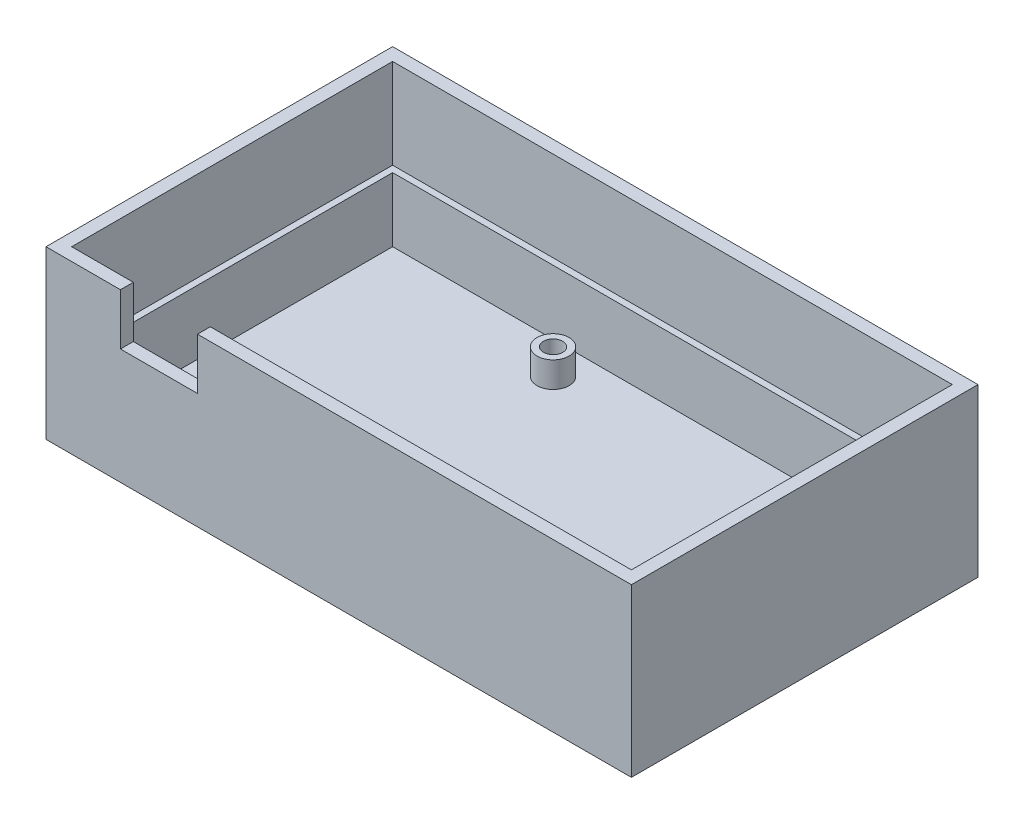
from build123d import *

# Parameters (mm, degrees)
CROQUIS1_W              = 91.2
CROQUIS1_H              = 54
SALIENTE_EXTRUIR1_DEPTH = 2
CROQUIS2_R              = 2.5
SALIENTE_EXTRUIR2_DEPTH = 4
CROQUIS3_R              = 1.5
CORTAR_EXTRUIR1_DEPTH   = 4
CROQUIS4_W              = 91.2
CROQUIS4_H              = 54
CROQUIS4_W_2            = 85.2
CROQUIS4_H_2            = 48
SALIENTE_EXTRUIR3_DEPTH = 24
CROQUIS7_W              = 87.2
CROQUIS7_H              = 50
CORTAR_EXTRUIR2_DEPTH   = 14
CROQUIS9_W              = 12
CROQUIS9_H              = 25
CORTAR_EXTRUIR3_DEPTH   = 8


with BuildPart() as part:
    # Croquis1 → Saliente-Extruir1 (new body)
    with BuildSketch(Plane(origin=(0, 0, 0), x_dir=(1, 0, 0), z_dir=(0, 1, 0))):
        with Locations((3, 0)):
            Rectangle(CROQUIS1_W, CROQUIS1_H)
    extrude(amount=SALIENTE_EXTRUIR1_DEPTH)

    # Croquis2 → Saliente-Extruir2 (add)
    with BuildSketch(Plane(origin=(0, 2, 0), x_dir=(1, 0, 0), z_dir=(0, 1, 0))):
        with Locations(Location((-9.6, -19, 0), (0, 0, 90))):
            Circle(CROQUIS2_R)
        with Locations(Location((-9.6, 19, 0), (0, 0, 90))):
            Circle(CROQUIS2_R)
        with Locations(Location((33.4, 19, 0), (0, 0, 90))):
            Circle(CROQUIS2_R)
        with Locations(Location((33.4, -19, 0), (0, 0, 90))):
            Circle(CROQUIS2_R)
    extrude(amount=SALIENTE_EXTRUIR2_DEPTH)

    # Croquis3 → Cortar-Extruir1 (cut)
    with BuildSketch(Plane(origin=(0, 6, 0), x_dir=(1, 0, 0), z_dir=(0, 1, 0))):
        with Locations(Location((-9.6, -19, 0), (0, 0, 270))):
            Circle(CROQUIS3_R)
        with Locations(Location((33.4, -19, 0), (0, 0, 270))):
            Circle(CROQUIS3_R)
        with Locations(Location((33.4, 19, 0), (0, 0, 270))):
            Circle(CROQUIS3_R)
        with Locations(Location((-9.6, 19, 0), (0, 0, 270))):
            Circle(CROQUIS3_R)
    extrude(amount=-CORTAR_EXTRUIR1_DEPTH, mode=Mode.SUBTRACT)

    # Croquis4 → Saliente-Extruir3 (add)
    with BuildSketch(Plane(origin=(0, 2, 0), x_dir=(1, 0, 0), z_dir=(0, 1, 0))):
        with Locations((3, 0)):
            Rectangle(CROQUIS4_W, CROQUIS4_H)
        with Locations((3, 0)):
            Rectangle(CROQUIS4_W_2, CROQUIS4_H_2, mode=Mode.SUBTRACT)
    extrude(amount=SALIENTE_EXTRUIR3_DEPTH)

    # Croquis7 → Cortar-Extruir2 (cut)
    with BuildSketch(Plane(origin=(0, 26, 0), x_dir=(1, 0, 0), z_dir=(0, 1, 0))):
        with Locations((3, 0)):
            Rectangle(CROQUIS7_W, CROQUIS7_H)
    extrude(amount=-CORTAR_EXTRUIR2_DEPTH, mode=Mode.SUBTRACT)

    # Croquis9 → Cortar-Extruir3 (cut)
    with BuildSketch(Plane(origin=(0, 26, 0), x_dir=(1, 0, 0), z_dir=(0, 1, 0))):
        with Locations((-25, -23)):
            Rectangle(CROQUIS9_W, CROQUIS9_H)
    extrude(amount=-CORTAR_EXTRUIR3_DEPTH, mode=Mode.SUBTRACT)


solid = part.part
